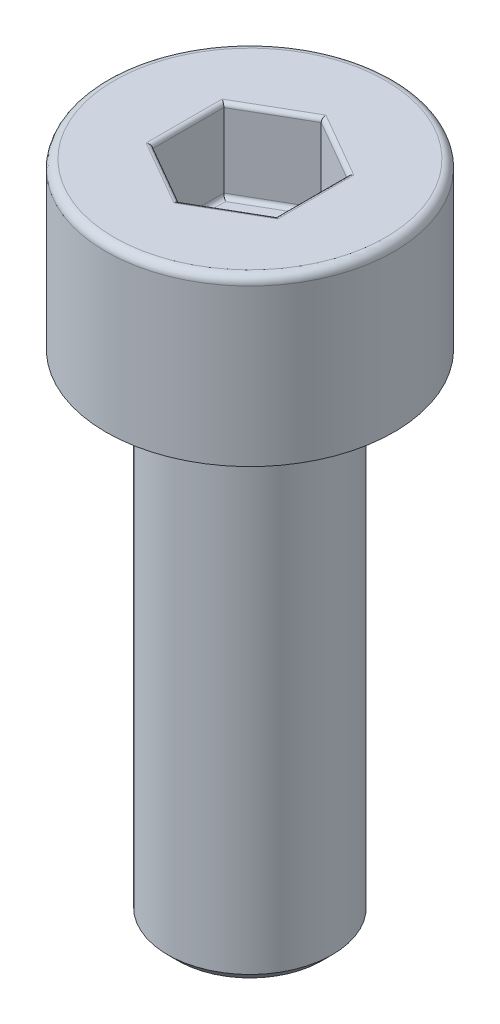
from build123d import *

# Parameters (mm, degrees)
CHAMFER1_SIZE      = 0.25
FILLET1_R          = 0.2
CUT_EXTRUDE1_DEPTH = 2
FILLET2_R          = 0.1


with BuildPart() as part:
    # Sketch1 → Revolve1 (revolve)
    with BuildSketch(Plane.XY, mode=Mode.PRIVATE) as revolve1_sk:
        Polygon((0, -16), (-2, -16), (-2, -4), (-3.5, -4), (-3.5, 0), (0, 0), align=None)
    revolve(revolve1_sk.sketch.rotate(Axis((0, 0, 0), (0, -1, 0)), 270), axis=Axis((0, 0, 0), (0, -1, 0)))

    # Chamfer1
    chamfer1_edges = [part.edges().sort_by_distance(p)[0] for p in [
        (0, -4, -2),
        (0, -16, -2),
    ]]
    chamfer(chamfer1_edges, length=CHAMFER1_SIZE)

    # Fillet1
    fillet1_edges = [part.edges().sort_by_distance(p)[0] for p in [
        (0, 0, -3.5),
    ]]
    fillet(fillet1_edges, radius=FILLET1_R)

    # Sketch2 → Cut-Extrude1 (cut)
    with BuildSketch(Plane(origin=(0, 0, 0), x_dir=(1, 0, 0), z_dir=(0, 1, 0))):
        Polygon((0, 1.732050808), (-1.5, 0.866025404), (-1.5, -0.866025404), (0, -1.732050808), (1.5, -0.866025404), (1.5, 0.866025404), align=None)
    extrude(amount=-CUT_EXTRUDE1_DEPTH, mode=Mode.SUBTRACT)

    # Fillet2
    fillet2_edges = [part.edges().sort_by_distance(p)[0] for p in [
        (0.75, -2, -1.299038106),
        (1.5, -2, 0),
        (0.75, -2, 1.299038106),
        (-0.75, -2, 1.299038106),
        (-1.5, -2, 0),
        (-0.75, -2, -1.299038106),
        (0.75, 0, -1.299038106),
        (-0.75, 0, -1.299038106),
        (-1.5, 0, 0),
        (-0.75, 0, 1.299038106),
        (0.75, 0, 1.299038106),
        (1.5, 0, 0),
    ]]
    fillet(fillet2_edges, radius=FILLET2_R)


solid = part.part
